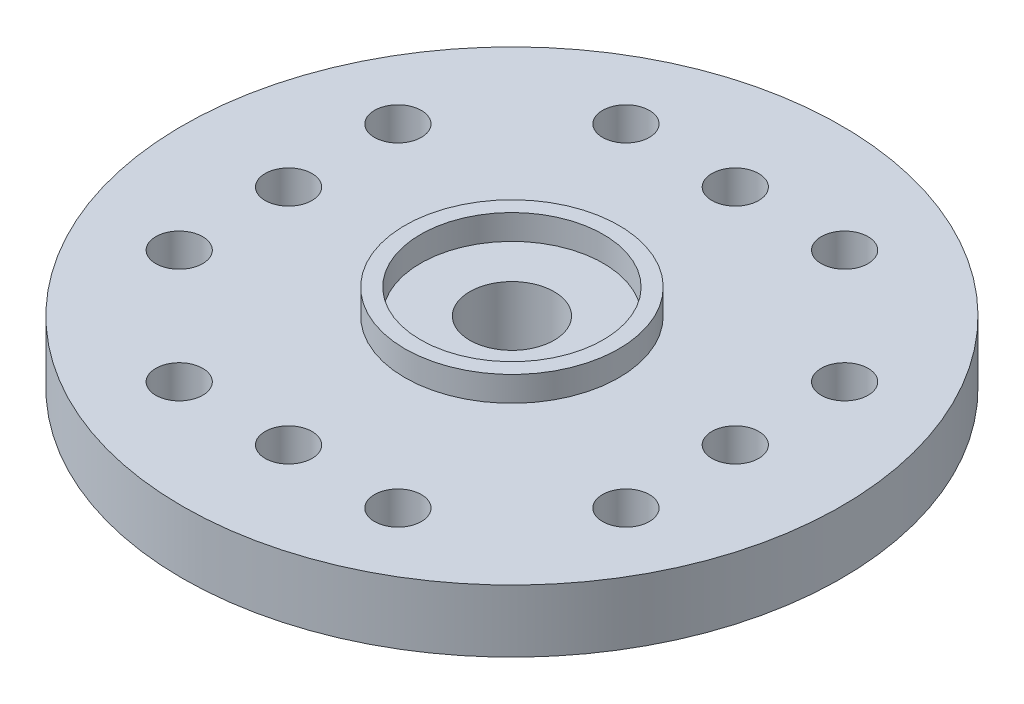
from build123d import *

# Parameters (mm, degrees)
SKETCH1_R                           = 4.35
REBAIXO_DE_ENCAIXE_DEPTH            = 2.6
SKETCH14_R                          = 2.45
FURO_DE_ENCAIXE_SERVO_DEPTH         = 3
SKETCH5_R                           = 10.55
SKETCH5_R_2                         = 1.35
BASE_REDONDA_DEPTH                  = 2
SKETCH8_R                           = 3.425
SKETCH8_R_2                         = 2.925
RESSALTO_DEPTH                      = 0.8
SKETCH9_R                           = 0.75
FUROS_DE_FIXA_O_CARGA_REDONDO_DEPTH = 16.612975373


with BuildPart() as part:
    # Sketch1 → Rebaixo de Encaixe (new body)
    with BuildSketch(Plane(origin=(0, 0, 0), x_dir=(1, 0, 0), z_dir=(0, 1, 0))):
        with Locations(Location((0, 0, 0), (0, 0, 270))):
            Circle(SKETCH1_R)
    extrude(amount=REBAIXO_DE_ENCAIXE_DEPTH)

    # Sketch14 → Furo de Encaixe - Servo (cut)
    with BuildSketch(Plane.XZ):
        with Locations(Location((0, 0, 0), (0, 0, 270))):
            Circle(SKETCH14_R)
    extrude(amount=-FURO_DE_ENCAIXE_SERVO_DEPTH, mode=Mode.SUBTRACT)

    # Sketch5 → Base Redonda (add)
    with BuildSketch(Plane(origin=(0, 2.6, 0), x_dir=(1, 0, 0), z_dir=(0, 1, 0))):
        with Locations(Location((0, 0, 0), (0, 0, 270))):
            Circle(SKETCH5_R)
        with Locations(Location((0, 0, 0), (0, 0, 270))):
            Circle(SKETCH5_R_2, mode=Mode.SUBTRACT)
    extrude(amount=BASE_REDONDA_DEPTH)

    # Sketch8 → Ressalto (add)
    with BuildSketch(Plane(origin=(0, 4.6, 0), x_dir=(1, 0, 0), z_dir=(0, 1, 0))):
        with Locations(Location((0, 0, 0), (0, 0, 270))):
            Circle(SKETCH8_R)
        with Locations(Location((0, 0, 0), (0, 0, 270))):
            Circle(SKETCH8_R_2, mode=Mode.SUBTRACT)
    extrude(amount=RESSALTO_DEPTH)

    # Sketch9 → Furos de Fixação - Carga Redondo (cut, through all)
    with BuildSketch(Plane(origin=(0, 4.6, 0), x_dir=(1, 0, 0), z_dir=(0, 1, 0))):
        with Locations(Location((0, 7.15, 0), (0, 0, 270))):
            Circle(SKETCH9_R)
        with Locations(Location((3.5, 7.15, 0), (0, 0, 270))):
            Circle(SKETCH9_R)
        with Locations(Location((-3.5, 7.15, 0), (0, 0, 270))):
            Circle(SKETCH9_R)
        with Locations(Location((7.15, 3.5, 0), (0, 0, 270))):
            Circle(SKETCH9_R)
        with Locations(Location((7.15, 0, 0), (0, 0, 270))):
            Circle(SKETCH9_R)
        with Locations(Location((7.15, -3.5, 0), (0, 0, 270))):
            Circle(SKETCH9_R)
        with Locations(Location((3.5, -7.15, 0), (0, 0, 270))):
            Circle(SKETCH9_R)
        with Locations(Location((0, -7.15, 0), (0, 0, 270))):
            Circle(SKETCH9_R)
        with Locations(Location((-3.5, -7.15, 0), (0, 0, 270))):
            Circle(SKETCH9_R)
        with Locations(Location((-7.15, -3.5, 0), (0, 0, 270))):
            Circle(SKETCH9_R)
        with Locations(Location((-7.15, 0, 0), (0, 0, 270))):
            Circle(SKETCH9_R)
        with Locations(Location((-7.15, 3.5, 0), (0, 0, 270))):
            Circle(SKETCH9_R)
    extrude(amount=-FUROS_DE_FIXA_O_CARGA_REDONDO_DEPTH, mode=Mode.SUBTRACT)


solid = part.part
